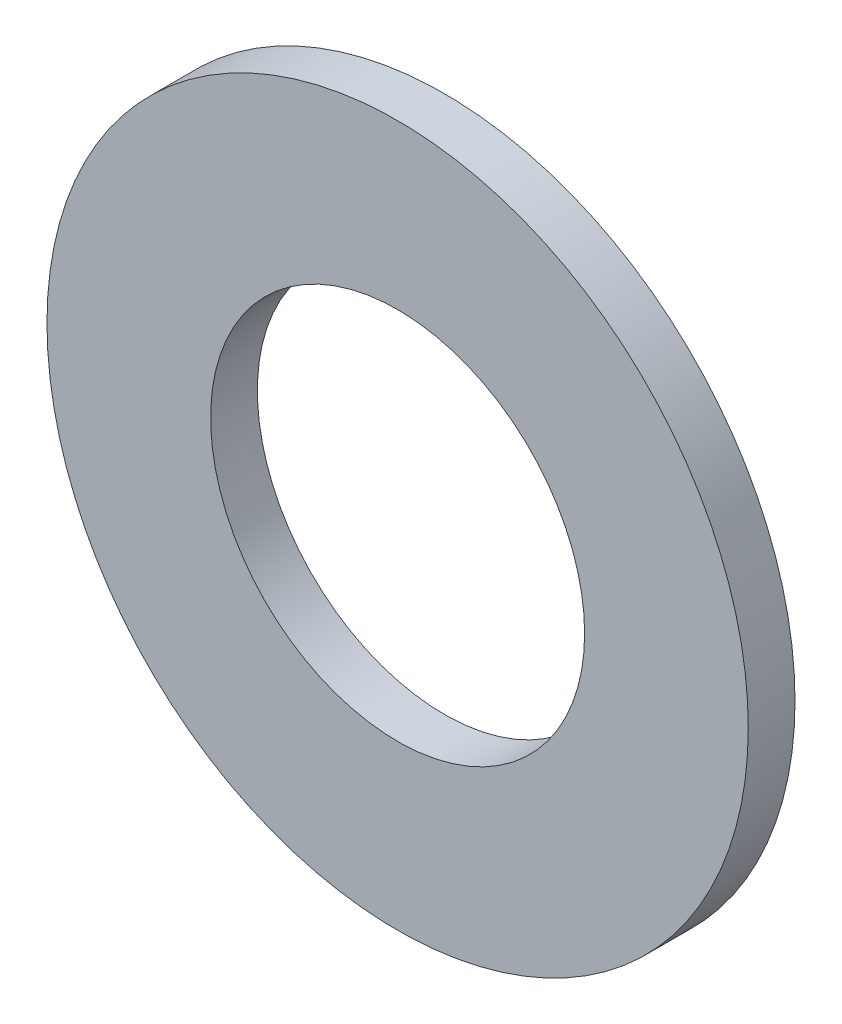
from build123d import *

# Parameters (mm, degrees)
ESQUISSE1_R        = 7.5
ESQUISSE1_R_2      = 4
BOSS_EXTRU_1_DEPTH = 1


with BuildPart() as part:
    # Esquisse1 → Boss.-Extru.1 (new body)
    with BuildSketch(Plane.XY):
        with Locations((-17.266375618, 15.576677852)):
            Circle(ESQUISSE1_R)
        with Locations((-17.266375618, 15.576677852)):
            Circle(ESQUISSE1_R_2, mode=Mode.SUBTRACT)
    extrude(amount=BOSS_EXTRU_1_DEPTH)


solid = part.part
